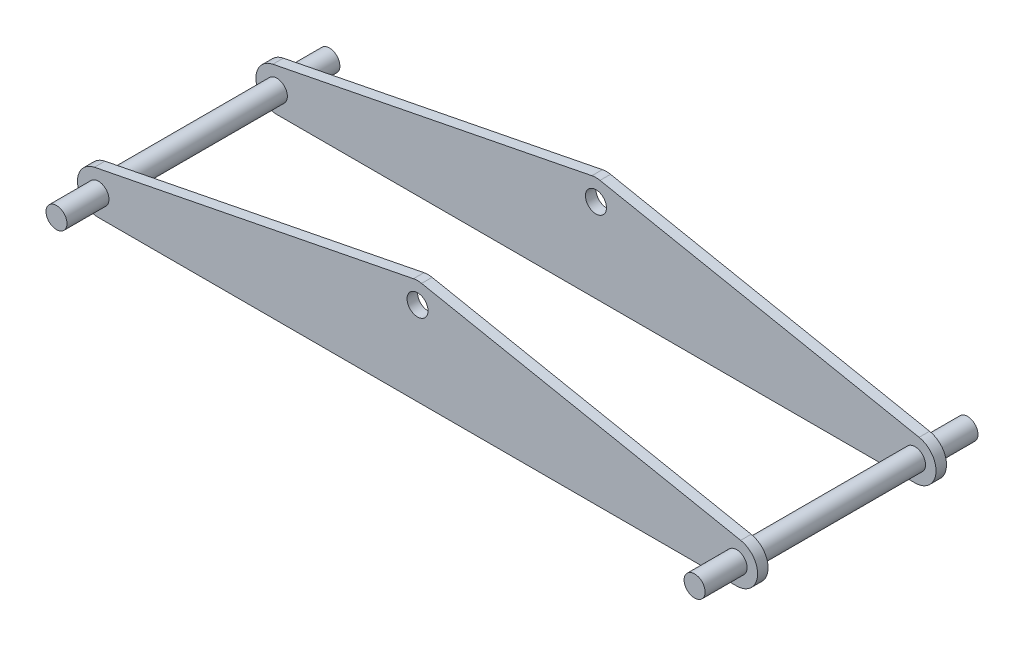
from build123d import *

# Parameters (mm, degrees)
SKETCH1_R                = 31.75
BOSS_EXTRUDE1_DEPTH      = 15.875
BOSS_EXTRUDE3_DEPTH      = 666.75
BOSS_EXTRUDE3_DEPTH_BACK = 158.75
SKETCH4_R                = 31.75
SKETCH5_R                = 31.75
BOSS_EXTRUDE4_DEPTH      = 31.75


with BuildPart() as part:
    # Sketch1 → Boss-Extrude1 (new, symmetric)
    with BuildSketch(Plane.XY):
        with BuildLine():
            Line((977.495697525, 62.298200796), (12.295697525, 252.798200796))
            ThreePointArc((12.295697525, 252.798200796), (0, 254), (-12.295697525, 252.798200796))
            Line((-12.295697525, 252.798200796), (-977.495697525, 62.298200796))
            ThreePointArc((-977.495697525, 62.298200796), (-1028.398836028, -6.177145355), (-965.2, -63.5))
            Line((-965.2, -63.5), (965.2, -63.5))
            ThreePointArc((965.2, -63.5), (1028.398836028, -6.177145355), (977.495697525, 62.298200796))
        make_face()
        with Locations((0, 190.5)):
            Circle(SKETCH1_R, mode=Mode.SUBTRACT)
        with Locations((-965.2, 0)):
            Circle(SKETCH1_R, mode=Mode.SUBTRACT)
        with Locations(Location((965.2, 0, 0), (0, 0, 180))):
            Circle(SKETCH1_R, mode=Mode.SUBTRACT)
    extrude(amount=BOSS_EXTRUDE1_DEPTH, both=True)

    # Sketch4 → Boss-Extrude3 (add, two sides: drawn at the far end of the back side and taken through both)
    with BuildSketch(Plane(origin=(0, 0, -15.875), x_dir=(-1, 0, 0), z_dir=(0, 0, -1)).offset(-BOSS_EXTRUDE3_DEPTH_BACK)):
        with Locations(Location((-965.2, 0, 0), (0, 0, 180))):
            Circle(SKETCH4_R)
        with Locations(Location((965.2, 0, 0), (0, 0, 180))):
            Circle(SKETCH4_R)
    extrude(amount=BOSS_EXTRUDE3_DEPTH + BOSS_EXTRUDE3_DEPTH_BACK)


with BuildPart() as body_2:
    # Sketch5 → Boss-Extrude4 (new body)
    with BuildSketch(Plane(origin=(0, 0, -523.875), x_dir=(-1, 0, 0), z_dir=(0, 0, -1))):
        with BuildLine():
            Line((977.495697525, 62.298200796), (12.295697525, 252.798200796))
            ThreePointArc((12.295697525, 252.798200796), (0, 254), (-12.295697525, 252.798200796))
            Line((-12.295697525, 252.798200796), (-977.495697525, 62.298200796))
            ThreePointArc((-977.495697525, 62.298200796), (-1028.398836028, -6.177145355), (-965.2, -63.5))
            Line((-965.2, -63.5), (965.2, -63.5))
            ThreePointArc((965.2, -63.5), (1028.398836028, -6.177145355), (977.495697525, 62.298200796))
        make_face()
        with Locations((0, 190.5)):
            Circle(SKETCH5_R, mode=Mode.SUBTRACT)
        with Locations((965.2, 0)):
            Circle(SKETCH5_R, mode=Mode.SUBTRACT)
        with Locations((-965.2, 0)):
            Circle(SKETCH5_R, mode=Mode.SUBTRACT)
    extrude(amount=BOSS_EXTRUDE4_DEPTH)


solid = Compound([part.part, body_2.part])
